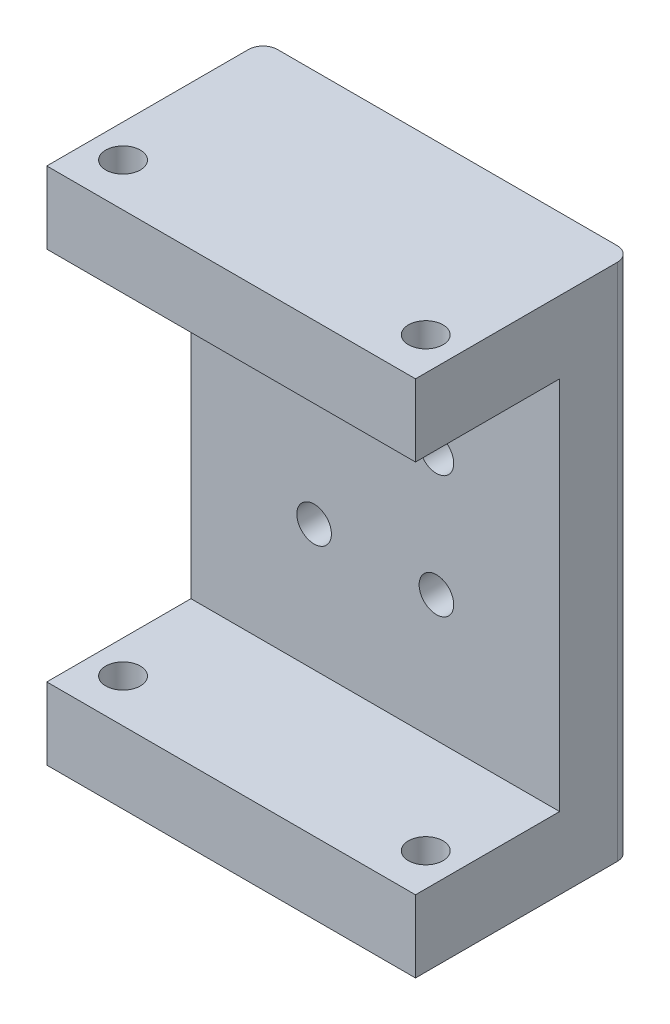
from build123d import *

# Parameters (mm, degrees)
SKETCH_1_W          = 25.58
SKETCH_1_H          = 36
EXTRUDE_1_DEPTH     = 15
SKETCH_2_W          = 10
SKETCH_2_H          = 26
CUT_EXTRUDE_1_DEPTH = 35.689139511
HOLE_WIZARD_M2_1_D  = 2.4
FILLET_1_R          = 1
SKETCH_5_R          = 4.25
CUT_EXTRUDE_2_DEPTH = 1.5
HOLE_WIZARD_M2_2_D  = 2.4


with BuildPart() as part:
    # ｽｹｯﾁ1 → ﾎﾞｽ - 押し出し1 (new body)
    with BuildSketch(Plane.XY):
        Rectangle(SKETCH_1_W, SKETCH_1_H)
    extrude(amount=EXTRUDE_1_DEPTH)

    # ｽｹｯﾁ2 → ｶｯﾄ - 押し出し1 (cut, through all)
    with BuildSketch(Plane.ZY.offset(12.79)):
        with Locations((10, 0)):
            Rectangle(SKETCH_2_W, SKETCH_2_H)
    extrude(amount=-CUT_EXTRUDE_1_DEPTH, mode=Mode.SUBTRACT)

    # M2 すきま穴1 (through all)
    with Locations(Plane(origin=(0, 18, 0), x_dir=(1, 0, 0), z_dir=(0, 1, 0))):
        with Locations((-10.5, -12), (10.5, -12)):
            Hole(HOLE_WIZARD_M2_1_D / 2)

    # ﾌｨﾚｯﾄ1
    fillet_1_edges = [part.edges().sort_by_distance(p)[0] for p in [
        (-12.79, 0, 0),
        (12.79, 0, 0),
    ]]
    fillet(fillet_1_edges, radius=FILLET_1_R)

    # ｽｹｯﾁ5 → ｶｯﾄ - 押し出し2 (cut)
    with BuildSketch(Plane(origin=(0, 0, 0), x_dir=(-1, 0, 0), z_dir=(0, 0, -1))):
        Circle(SKETCH_5_R)
    extrude(amount=-CUT_EXTRUDE_2_DEPTH, mode=Mode.SUBTRACT)

    # M2 すきま穴2 (through all)
    with Locations(Plane.XY.offset(5)):
        with Locations((4.242640687, 4.242640687), (-4.242640687, -4.242640687), (4.242640687, -4.242640687), (-4.242640687, 4.242640687)):
            Hole(HOLE_WIZARD_M2_2_D / 2)


solid = part.part
